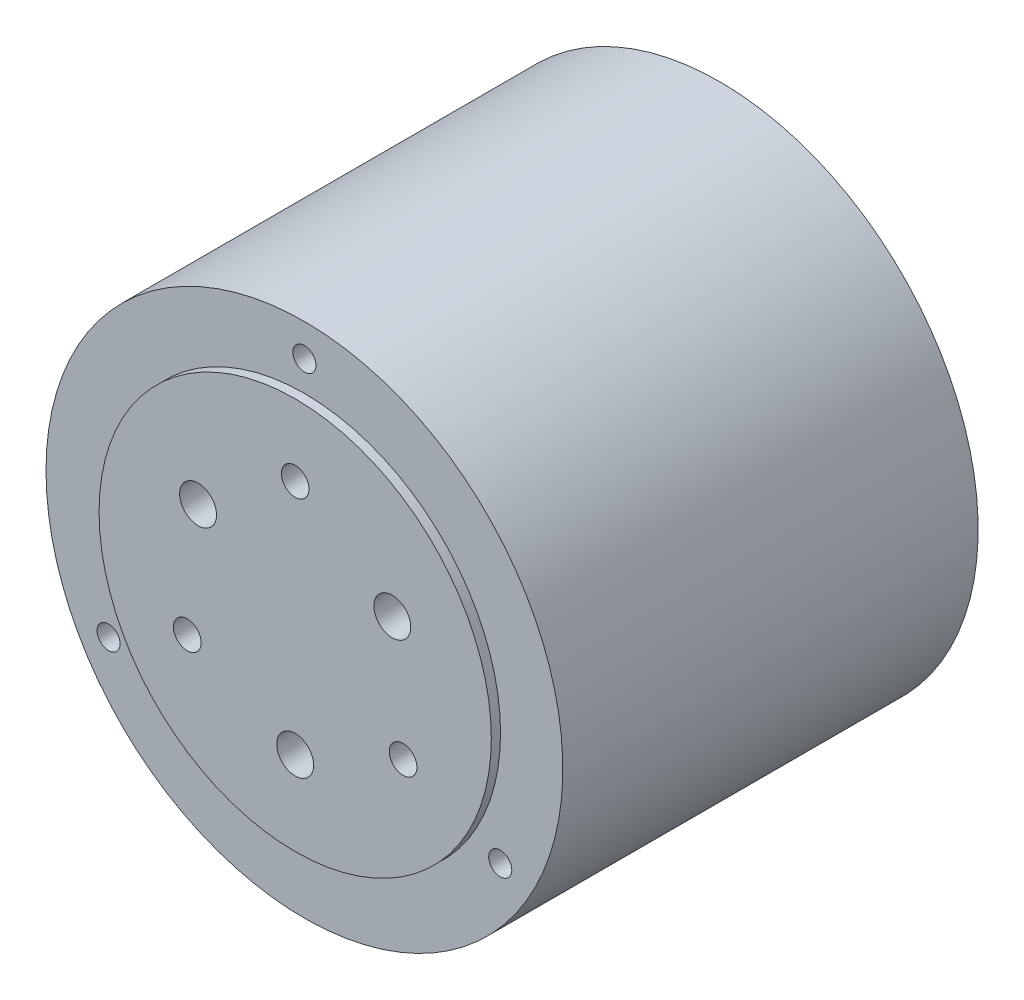
from build123d import *

# Parameters (mm, degrees)
SKETCH_1_R          = 28
EXTRUDE_1_DEPTH     = 45
SKETCH_2_R          = 1.25
CUT_EXTRUDE_1_DEPTH = 4
SKETCH_3_R          = 1.25
CUT_EXTRUDE_2_DEPTH = 5
SKETCH_4_R          = 21.25
EXTRUDE_2_DEPTH     = 1
SKETCH_5_R          = 1.5
CUT_EXTRUDE_3_DEPTH = 5
SKETCH_6_R          = 2
CUT_EXTRUDE_4_DEPTH = 5


with BuildPart() as part:
    # 草图1 → 凸台-拉伸1 (new body)
    with BuildSketch(Plane.XY):
        with Locations(Location((0, 0, 0), (0, 0, 180))):
            Circle(SKETCH_1_R)
    extrude(amount=EXTRUDE_1_DEPTH)

    # 草图2 → 切除-拉伸1 (cut)
    with BuildSketch(Plane(origin=(0, 0, 0), x_dir=(-1, 0, 0), z_dir=(0, 0, -1))):
        with Locations((19, 0)):
            Circle(SKETCH_2_R)
        with Locations((0, -19)):
            Circle(SKETCH_2_R)
        with Locations((-19, 0)):
            Circle(SKETCH_2_R)
        with Locations((0, 19)):
            Circle(SKETCH_2_R)
    extrude(amount=-CUT_EXTRUDE_1_DEPTH, mode=Mode.SUBTRACT)

    # 草图3 → 切除-拉伸2 (cut)
    with BuildSketch(Plane.XY.offset(45)):
        with Locations((0, 24.5)):
            Circle(SKETCH_3_R)
        with Locations((21.217622393, -12.25)):
            Circle(SKETCH_3_R)
        with Locations((-21.217622393, -12.25)):
            Circle(SKETCH_3_R)
    extrude(amount=-CUT_EXTRUDE_2_DEPTH, mode=Mode.SUBTRACT)

    # 草图4 → 凸台-拉伸2 (add)
    with BuildSketch(Plane.XY.offset(45)):
        Circle(SKETCH_4_R)
    extrude(amount=EXTRUDE_2_DEPTH)

    # 草图5 → 切除-拉伸3 (cut)
    with BuildSketch(Plane.XY.offset(46)):
        with Locations((0, 13.5)):
            Circle(SKETCH_5_R)
        with Locations((11.691342951, -6.75)):
            Circle(SKETCH_5_R)
        with Locations((-11.691342951, -6.75)):
            Circle(SKETCH_5_R)
    extrude(amount=-CUT_EXTRUDE_3_DEPTH, mode=Mode.SUBTRACT)

    # 草图6 → 切除-拉伸4 (cut)
    with BuildSketch(Plane.XY.offset(46)):
        with Locations((0, -12.15)):
            Circle(SKETCH_6_R)
        with Locations((-10.522208656, 6.075)):
            Circle(SKETCH_6_R)
        with Locations((10.522208656, 6.075)):
            Circle(SKETCH_6_R)
    extrude(amount=-CUT_EXTRUDE_4_DEPTH, mode=Mode.SUBTRACT)


solid = part.part
